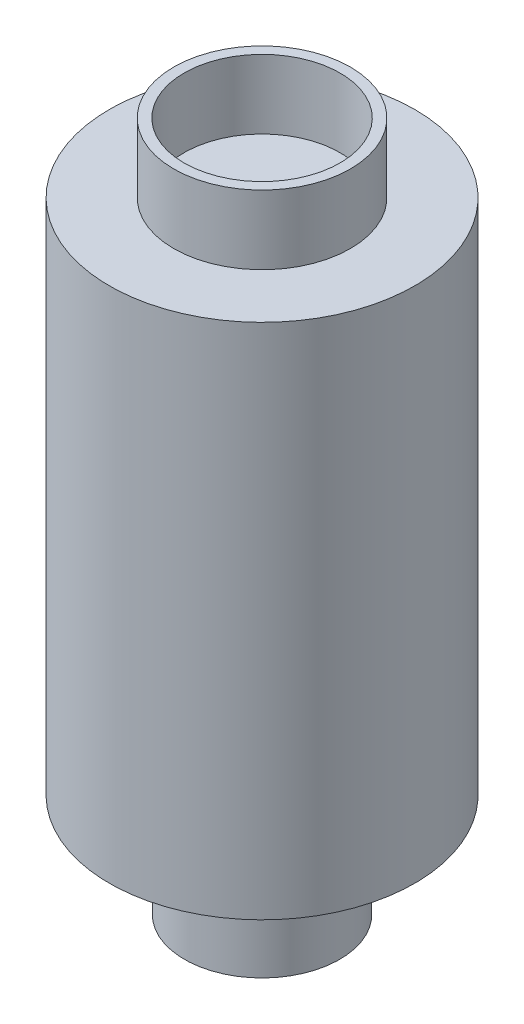
from build123d import *

# Parameters (mm, degrees)
SKETCH1_R           = 12.8
SKETCH1_R_2         = 11.3
BOSS_EXTRUDE1_DEPTH = 10
SKETCH2_R           = 22.139080492
BOSS_EXTRUDE2_DEPTH = 75
SKETCH3_R           = 11.25
SKETCH3_R_2         = 8.25
BOSS_EXTRUDE3_DEPTH = 15


with BuildPart() as part:
    # Sketch1 → Boss-Extrude1 (new body)
    with BuildSketch(Plane(origin=(0, 0, 0), x_dir=(1, 0, 0), z_dir=(0, 1, 0))):
        with Locations(Location((0, 0, 0), (0, 0, 270))):
            Circle(SKETCH1_R)
        with Locations(Location((0, 0, 0), (0, 0, 270))):
            Circle(SKETCH1_R_2, mode=Mode.SUBTRACT)
    extrude(amount=BOSS_EXTRUDE1_DEPTH)

    # Sketch2 → Boss-Extrude2 (add)
    with BuildSketch(Plane.XZ):
        with Locations(Location((0, 0, 0), (0, 0, 270))):
            Circle(SKETCH2_R)
    extrude(amount=BOSS_EXTRUDE2_DEPTH)

    # Sketch3 → Boss-Extrude3 (add)
    with BuildSketch(Plane.XZ.offset(75)):
        with Locations(Location((0, 0, 0), (0, 0, 270))):
            Circle(SKETCH3_R)
        with Locations(Location((0, 0, 0), (0, 0, 270))):
            Circle(SKETCH3_R_2, mode=Mode.SUBTRACT)
    extrude(amount=BOSS_EXTRUDE3_DEPTH)


solid = part.part
